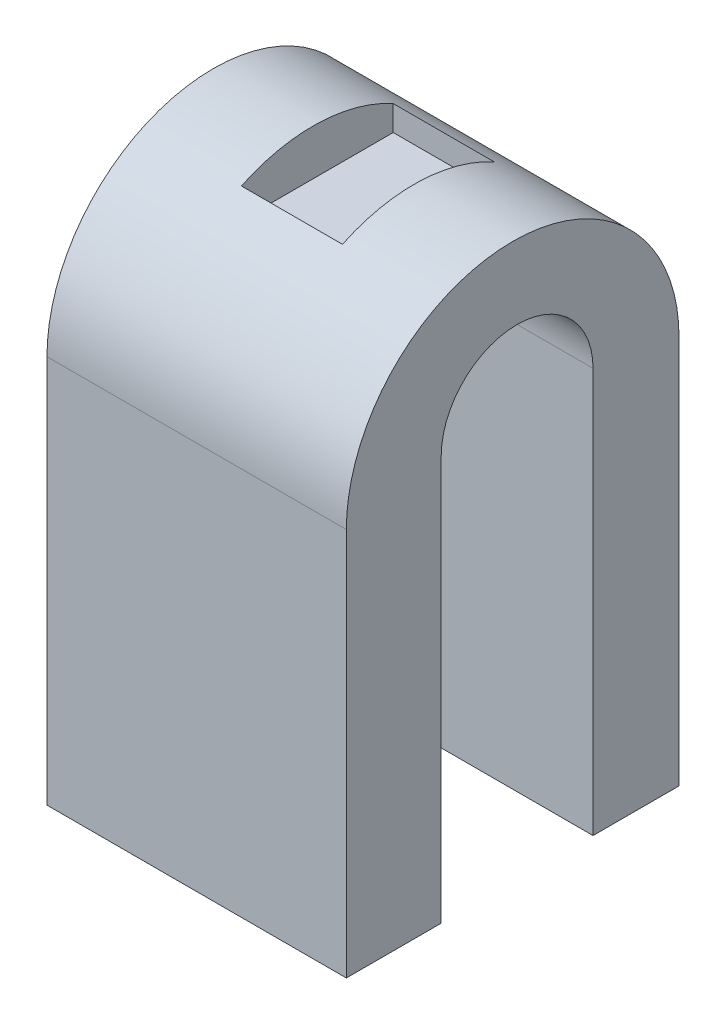
from build123d import *

# Parameters (mm, degrees)
BOSS_EXTRUDE3_DEPTH = 50
CUT_EXTRUDE2_DEPTH  = 120.036992567
SKETCH12_W          = 16.875844183
SKETCH12_H          = 25.353739704
CUT_EXTRUDE3_DEPTH  = 114.190623836


with BuildPart() as part:
    # Sketch7 → Boss-Extrude3 (new body)
    with BuildSketch(Plane(origin=(0, 0, 0), x_dir=(0, 0, -1), z_dir=(1, 0, 0))):
        with BuildLine():
            ThreePointArc((55.561833342, 64.861882699), (27.780916671, 92.64279937), (0, 64.861882699))
            Line((0, 64.861882699), (55.561833342, 64.861882699))
        make_face()
        with BuildLine():
            Line((55.561833342, 64.861882699), (0, 64.861882699))
            ThreePointArc((0, 64.861882699), (27.780916671, 37.080966028), (55.561833342, 64.861882699))
        make_face()
        with BuildLine():
            Line((0, 64.861882699), (0, 0))
            Line((0, 0), (55.561833342, 0))
            Line((55.561833342, 0), (55.561833342, 64.861882699))
            ThreePointArc((55.561833342, 64.861882699), (27.780916671, 37.080966028), (0, 64.861882699))
        make_face()
    extrude(amount=BOSS_EXTRUDE3_DEPTH)

    # Sketch8 → Cut-Extrude2 (cut, through all)
    with BuildSketch(Plane(origin=(50, 0, 0), x_dir=(0, 0, -1), z_dir=(1, 0, 0))):
        with BuildLine():
            ThreePointArc((41.196796873, 67.582158988), (28.519927021, 80.25902884), (15.843057169, 67.582158988))
            Line((15.843057169, 67.582158988), (41.196796873, 67.582158988))
        make_face()
        with BuildLine():
            Line((41.196796873, 67.582158988), (15.843057169, 67.582158988))
            ThreePointArc((15.843057169, 67.582158988), (28.519927021, 54.905289136), (41.196796873, 67.582158988))
        make_face()
        with BuildLine():
            ThreePointArc((41.196796873, 67.582158988), (28.519927021, 54.905289136), (15.843057169, 67.582158988))
            Line((15.843057169, 67.582158988), (15.843057169, 0))
            Line((15.843057169, 0), (41.196796873, 0))
            Line((41.196796873, 0), (41.196796873, 67.582158988))
        make_face()
    extrude(amount=-CUT_EXTRUDE2_DEPTH, mode=Mode.SUBTRACT)

    # Sketch12 → Cut-Extrude3 (cut, through all)
    with BuildSketch(Plane(origin=(0, 85, 0), x_dir=(1, 0, 0), z_dir=(0, 1, 0))):
        with Locations((25.070624904, 28.519927021)):
            Rectangle(SKETCH12_W, SKETCH12_H)
    extrude(amount=CUT_EXTRUDE3_DEPTH, mode=Mode.SUBTRACT)


solid = part.part
